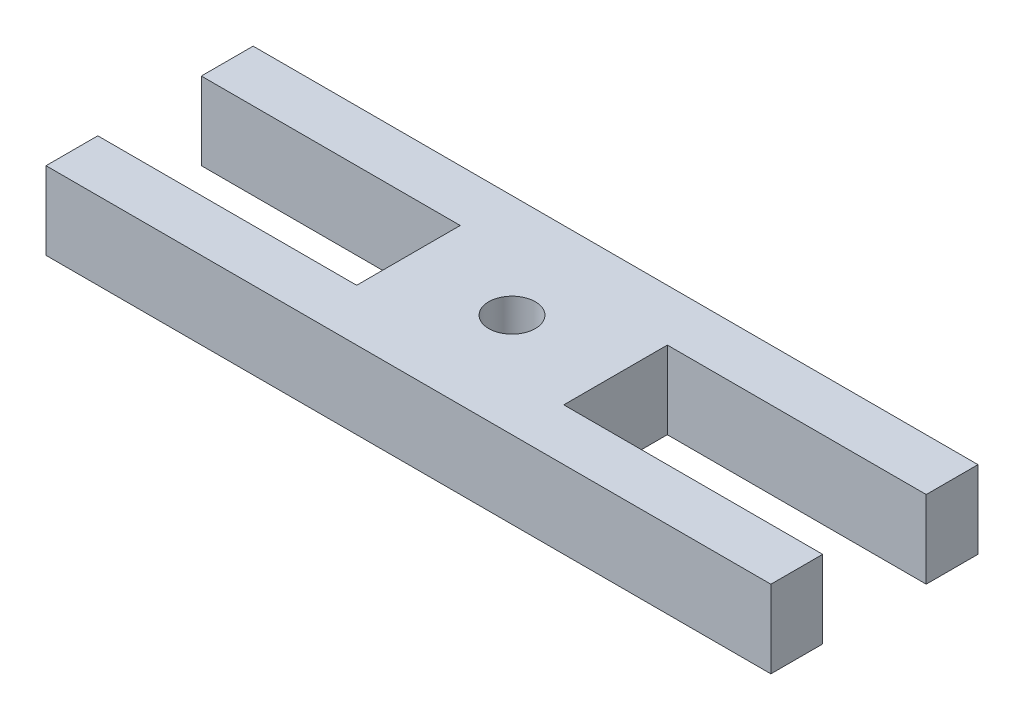
from build123d import *

# Parameters (mm, degrees)
SKETCH1_R           = 0.45
BOSS_EXTRUDE3_DEPTH = 1.5


with BuildPart() as part:
    # Sketch1 → Boss-Extrude3 (new body)
    with BuildSketch(Plane(origin=(0, 0, 0), x_dir=(1, 0, 0), z_dir=(0, 1, 0))):
        Polygon((-20.583073889, 25.40617028), (-20.583073889, 26.40617028), (-34.583073889, 26.40617028), (-34.583073889, 25.40617028), (-29.583073889, 25.40617028), (-29.583073889, 23.40617028), (-34.583073889, 23.40617028), (-34.583073889, 22.40617028), (-20.583073889, 22.40617028), (-20.583073889, 23.40617028), (-25.583073889, 23.40617028), (-25.583073889, 25.40617028), align=None)
        with Locations(Location((-27.583073889, 24.40617028, 0), (0, 0, 270))):
            Circle(SKETCH1_R, mode=Mode.SUBTRACT)
    extrude(amount=BOSS_EXTRUDE3_DEPTH)


solid = part.part
